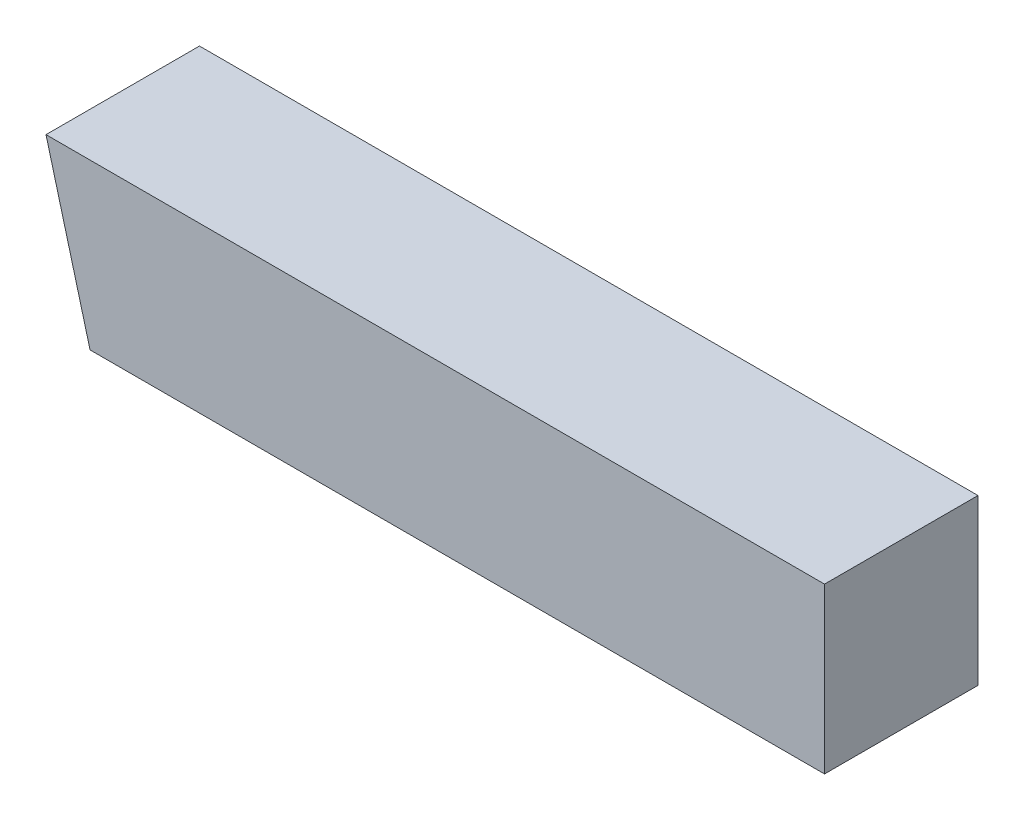
from build123d import *

# Parameters (mm, degrees)
BOSS_EXTRUDE1_DEPTH = 35.56


with BuildPart() as part:
    # Sketch1 → Boss-Extrude1 (new body)
    with BuildSketch(Plane.XY):
        Polygon((0, 0), (-170.18, 0), (-180.388864232, 38.1), (0, 38.1), align=None)
    extrude(amount=BOSS_EXTRUDE1_DEPTH)


solid = part.part
